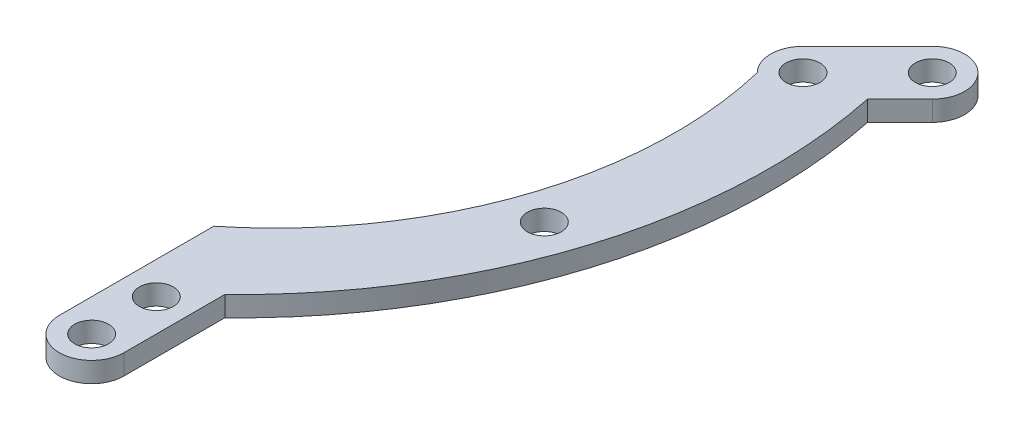
from build123d import *

# Parameters (mm, degrees)
SKETCH1_R           = 2.1
BOSS_EXTRUDE1_DEPTH = 2.5


with BuildPart() as part:
    # Sketch1 → Boss-Extrude1 (new body)
    with BuildSketch(Plane(origin=(0, 0, 0), x_dir=(1, 0, 0), z_dir=(0, 1, 0))):
        with BuildLine():
            Line((4, -36), (4, -40))
            ThreePointArc((4, -40), (0, -44), (-4, -40))
            Line((-4, -40), (-4, -32))
            Line((-4, -32), (-4, -20.894729077))
            ThreePointArc((-4, -20.894729077), (11.843809939, 1.649089261), (13.171572875, 29.171572875))
            ThreePointArc((13.171572875, 29.171572875), (12, 32), (13.171572875, 34.828427125))
            Line((13.171572875, 34.828427125), (21.171572875, 42.828427125))
            ThreePointArc((21.171572875, 42.828427125), (26.828427125, 42.828427125), (26.828427125, 37.171572875))
            Line((26.828427125, 37.171572875), (22.828427125, 33.171572875))
            ThreePointArc((22.828427125, 33.171572875), (21.232537081, 0.397959844), (4, -27.525081572))
            Line((4, -27.525081572), (4, -36))
        make_face()
        with Locations(Location((0, -32, 0), (0, 0, 270))):
            Circle(SKETCH1_R, mode=Mode.SUBTRACT)
        with Locations(Location((0, -40, 0), (0, 0, 270))):
            Circle(SKETCH1_R, mode=Mode.SUBTRACT)
        with Locations(Location((16, 32, 0), (0, 0, 270))):
            Circle(SKETCH1_R, mode=Mode.SUBTRACT)
        with Locations(Location((24, 40, 0), (0, 0, 270))):
            Circle(SKETCH1_R, mode=Mode.SUBTRACT)
        with Locations(Location((16, 0, 0), (0, 0, 270))):
            Circle(SKETCH1_R, mode=Mode.SUBTRACT)
    extrude(amount=BOSS_EXTRUDE1_DEPTH)


solid = part.part
